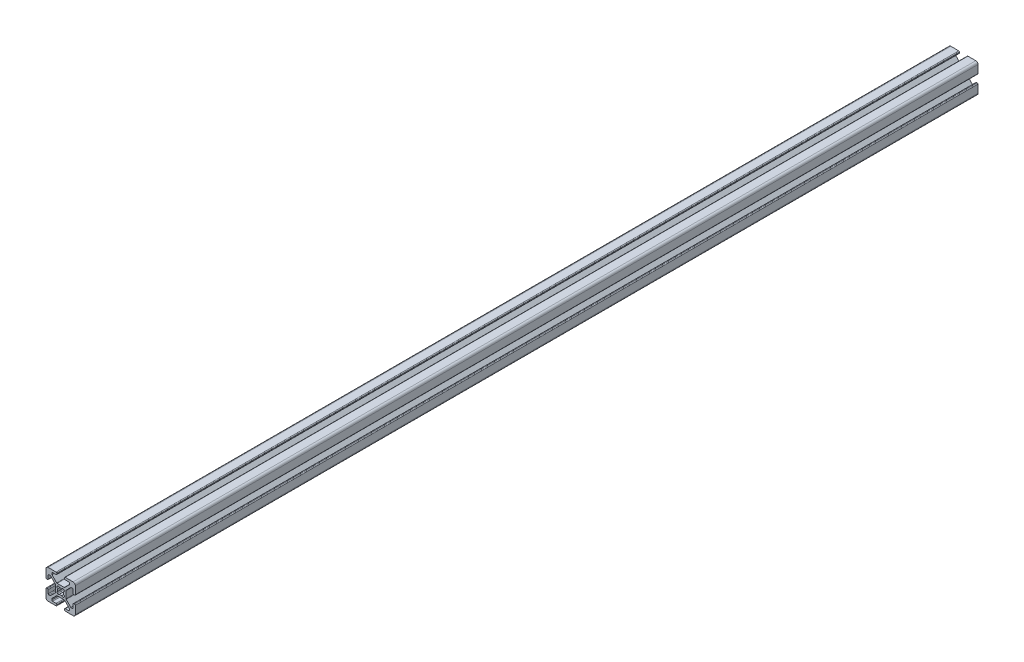
from build123d import *

# Parameters (mm, degrees)
BOSS_EXTRUDE1_DEPTH = 616


with BuildPart() as part:
    # Sketch2 → Boss-Extrude1 (new body)
    with BuildSketch(Plane.XY):
        with BuildLine():
            Line((-10, -3.138), (-10, -8.5))
            ThreePointArc((-10, -8.5), (-9.560660172, -9.560660172), (-8.5, -10))
            Line((-8.5, -10), (-3.138, -10))
            ThreePointArc((-3.138, -10), (-2.778789755, -9.851210245), (-2.63, -9.492))
            Line((-2.63, -9.492), (-2.63, -9.008))
            ThreePointArc((-2.63, -9.008), (-2.778789755, -8.648789755), (-3.138, -8.5))
            Line((-3.138, -8.5), (-5.487, -8.5))
            ThreePointArc((-5.487, -8.5), (-5.846210245, -8.351210245), (-5.995, -7.992))
            Line((-5.995, -7.992), (-5.995, -7.266240833))
            ThreePointArc((-5.995, -7.266240833), (-5.956330803, -7.07183765), (-5.846210245, -6.907030588))
            Line((-5.846210245, -6.907030588), (-2.742969412, -3.803789755))
            ThreePointArc((-2.742969412, -3.803789755), (-2.57816235, -3.693669197), (-2.383759167, -3.655))
            Line((-2.383759167, -3.655), (2.38407951, -3.655))
            ThreePointArc((2.38407951, -3.655), (2.578482694, -3.693669197), (2.743289755, -3.803789755))
            Line((2.743289755, -3.803789755), (5.846210245, -6.906710245))
            ThreePointArc((5.846210245, -6.906710245), (5.956330803, -7.071517306), (5.995, -7.26592049))
            Line((5.995, -7.26592049), (5.995, -7.992))
            ThreePointArc((5.995, -7.992), (5.846210245, -8.351210245), (5.487, -8.5))
            Line((5.487, -8.5), (3.138, -8.5))
            ThreePointArc((3.138, -8.5), (2.778789755, -8.648789755), (2.63, -9.008))
            Line((2.63, -9.008), (2.63, -9.492))
            ThreePointArc((2.63, -9.492), (2.778789755, -9.851210245), (3.138, -10))
            Line((3.138, -10), (8.5, -10))
            ThreePointArc((8.5, -10), (9.560660172, -9.560660172), (10, -8.5))
            Line((10, -8.5), (10, -3.138))
            ThreePointArc((10, -3.138), (9.851210245, -2.778789755), (9.492, -2.63))
            Line((9.492, -2.63), (9.008, -2.63))
            ThreePointArc((9.008, -2.63), (8.648789755, -2.778789755), (8.5, -3.138))
            Line((8.5, -3.138), (8.5, -5.487))
            ThreePointArc((8.5, -5.487), (8.351210245, -5.846210245), (7.992, -5.995))
            Line((7.992, -5.995), (7.266240833, -5.995))
            ThreePointArc((7.266240833, -5.995), (7.07183765, -5.956330803), (6.907030588, -5.846210245))
            Line((6.907030588, -5.846210245), (3.803789755, -2.742969412))
            ThreePointArc((3.803789755, -2.742969412), (3.693669197, -2.57816235), (3.655, -2.383759167))
            Line((3.655, -2.383759167), (3.655, 2.38407951))
            ThreePointArc((3.655, 2.38407951), (3.693669197, 2.578482694), (3.803789755, 2.743289755))
            Line((3.803789755, 2.743289755), (6.906710245, 5.846210245))
            ThreePointArc((6.906710245, 5.846210245), (7.071517306, 5.956330803), (7.26592049, 5.995))
            Line((7.26592049, 5.995), (7.992, 5.995))
            ThreePointArc((7.992, 5.995), (8.351210245, 5.846210245), (8.5, 5.487))
            Line((8.5, 5.487), (8.5, 3.138))
            ThreePointArc((8.5, 3.138), (8.648789755, 2.778789755), (9.008, 2.63))
            Line((9.008, 2.63), (9.492, 2.63))
            ThreePointArc((9.492, 2.63), (9.851210245, 2.778789755), (10, 3.138))
            Line((10, 3.138), (10, 8.5))
            ThreePointArc((10, 8.5), (9.560660172, 9.560660172), (8.5, 10))
            Line((8.5, 10), (3.138, 10))
            ThreePointArc((3.138, 10), (2.778789755, 9.851210245), (2.63, 9.492))
            Line((2.63, 9.492), (2.63, 9.008))
            ThreePointArc((2.63, 9.008), (2.778789755, 8.648789755), (3.138, 8.5))
            Line((3.138, 8.5), (5.487, 8.5))
            ThreePointArc((5.487, 8.5), (5.846210245, 8.351210245), (5.995, 7.992))
            Line((5.995, 7.992), (5.995, 7.266240833))
            ThreePointArc((5.995, 7.266240833), (5.956330803, 7.07183765), (5.846210245, 6.907030588))
            Line((5.846210245, 6.907030588), (2.742969412, 3.803789755))
            ThreePointArc((2.742969412, 3.803789755), (2.57816235, 3.693669197), (2.383759167, 3.655))
            Line((2.383759167, 3.655), (-2.38407951, 3.655))
            ThreePointArc((-2.38407951, 3.655), (-2.578482694, 3.693669197), (-2.743289755, 3.803789755))
            Line((-2.743289755, 3.803789755), (-5.846210245, 6.906710245))
            ThreePointArc((-5.846210245, 6.906710245), (-5.956330803, 7.071517306), (-5.995, 7.26592049))
            Line((-5.995, 7.26592049), (-5.995, 7.992))
            ThreePointArc((-5.995, 7.992), (-5.846210245, 8.351210245), (-5.487, 8.5))
            Line((-5.487, 8.5), (-3.138, 8.5))
            ThreePointArc((-3.138, 8.5), (-2.778789755, 8.648789755), (-2.63, 9.008))
            Line((-2.63, 9.008), (-2.63, 9.492))
            ThreePointArc((-2.63, 9.492), (-2.778789755, 9.851210245), (-3.138, 10))
            Line((-3.138, 10), (-8.5, 10))
            ThreePointArc((-8.5, 10), (-9.560660172, 9.560660172), (-10, 8.5))
            Line((-10, 8.5), (-10, 3.138))
            ThreePointArc((-10, 3.138), (-9.851210245, 2.778789755), (-9.492, 2.63))
            Line((-9.492, 2.63), (-9.008, 2.63))
            ThreePointArc((-9.008, 2.63), (-8.648789755, 2.778789755), (-8.5, 3.138))
            Line((-8.5, 3.138), (-8.5, 5.487))
            ThreePointArc((-8.5, 5.487), (-8.351210245, 5.846210245), (-7.992, 5.995))
            Line((-7.992, 5.995), (-7.266240833, 5.995))
            ThreePointArc((-7.266240833, 5.995), (-7.07183765, 5.956330803), (-6.907030588, 5.846210245))
            Line((-6.907030588, 5.846210245), (-3.803789755, 2.742969412))
            ThreePointArc((-3.803789755, 2.742969412), (-3.693669197, 2.57816235), (-3.655, 2.383759167))
            Line((-3.655, 2.383759167), (-3.655, -2.38407951))
            ThreePointArc((-3.655, -2.38407951), (-3.693669197, -2.578482694), (-3.803789755, -2.743289755))
            Line((-3.803789755, -2.743289755), (-6.906710245, -5.846210245))
            ThreePointArc((-6.906710245, -5.846210245), (-7.071517306, -5.956330803), (-7.26592049, -5.995))
            Line((-7.26592049, -5.995), (-7.992, -5.995))
            ThreePointArc((-7.992, -5.995), (-8.351210245, -5.846210245), (-8.5, -5.487))
            Line((-8.5, -5.487), (-8.5, -3.138))
            ThreePointArc((-8.5, -3.138), (-8.648789755, -2.778789755), (-9.008, -2.63))
            Line((-9.008, -2.63), (-9.492, -2.63))
            ThreePointArc((-9.492, -2.63), (-9.851210245, -2.778789755), (-10, -3.138))
        make_face()
        with BuildLine():
            Line((-2.124493037, 2.304493037), (-2.304493037, 2.124493037))
            ThreePointArc((-2.304493037, 2.124493037), (-2.506016078, 1.35638567), (-1.935777391, 0.803729988))
            ThreePointArc((-1.935777391, 0.803729988), (-2.096, 0), (-1.935777391, -0.803729988))
            ThreePointArc((-1.935777391, -0.803729988), (-2.506016078, -1.35638567), (-2.304493037, -2.124493037))
            Line((-2.304493037, -2.124493037), (-2.124493037, -2.304493037))
            ThreePointArc((-2.124493037, -2.304493037), (-1.35638567, -2.506016078), (-0.803729988, -1.935777391))
            ThreePointArc((-0.803729988, -1.935777391), (0, -2.096), (0.803729988, -1.935777391))
            ThreePointArc((0.803729988, -1.935777391), (1.35638567, -2.506016078), (2.124493037, -2.304493037))
            Line((2.124493037, -2.304493037), (2.304493037, -2.124493037))
            ThreePointArc((2.304493037, -2.124493037), (2.506016078, -1.35638567), (1.935777391, -0.803729988))
            ThreePointArc((1.935777391, -0.803729988), (2.096, 0), (1.935777391, 0.803729988))
            ThreePointArc((1.935777391, 0.803729988), (2.506016078, 1.35638567), (2.304493037, 2.124493037))
            Line((2.304493037, 2.124493037), (2.124493037, 2.304493037))
            ThreePointArc((2.124493037, 2.304493037), (1.35638567, 2.506016078), (0.803729988, 1.935777391))
            ThreePointArc((0.803729988, 1.935777391), (0, 2.096), (-0.803729988, 1.935777391))
            ThreePointArc((-0.803729988, 1.935777391), (-1.35638567, 2.506016078), (-2.124493037, 2.304493037))
        make_face(mode=Mode.SUBTRACT)
    extrude(amount=-BOSS_EXTRUDE1_DEPTH)


solid = part.part
